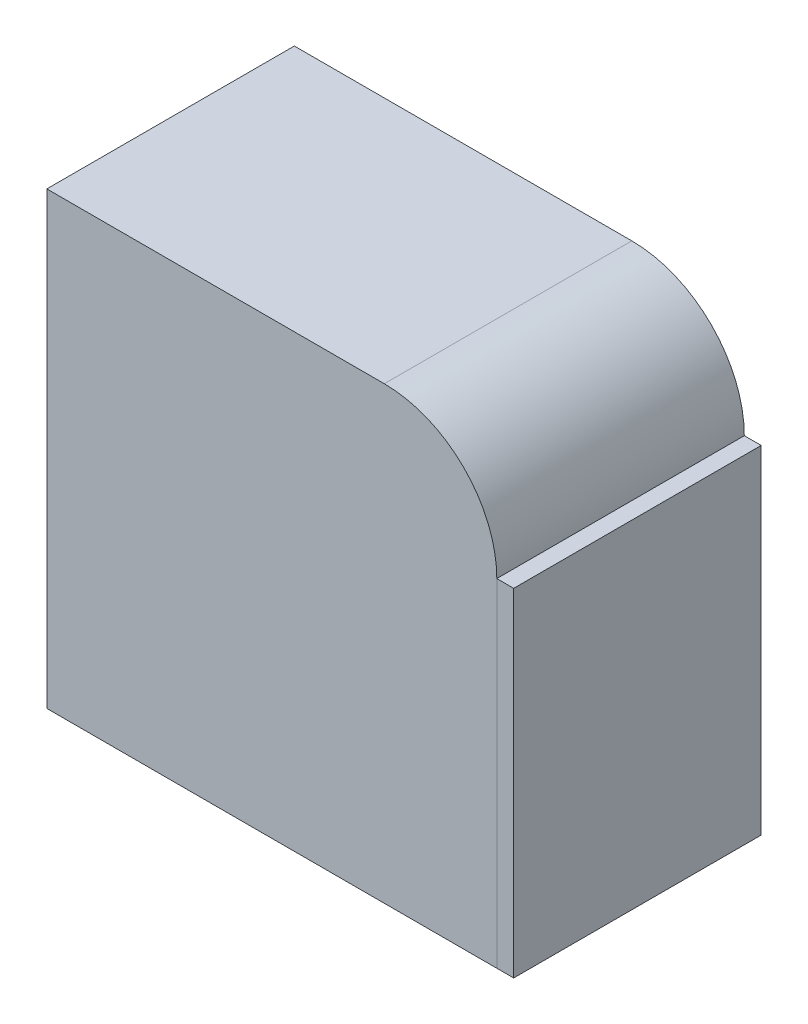
from build123d import *

# Parameters (mm, degrees)
BOSS_EXTRU_1_DEPTH = 11
ESQUISSE2_W        = 22
ESQUISSE2_H        = 30
BOSS_EXTRU_2_DEPTH = 1.5


with BuildPart() as part:
    # Esquisse1 → Boss.-Extru.1 (new, symmetric)
    with BuildSketch(Plane.XY):
        with BuildLine():
            Line((-58, -15), (-28, -15))
            ThreePointArc((-28, -15), (-20.928932188, -17.928932188), (-18, -25))
            Line((-18, -25), (-18, -55))
            Line((-18, -55), (-58, -55))
            Line((-58, -55), (-58, -15))
        make_face()
    extrude(amount=BOSS_EXTRU_1_DEPTH, both=True)


with BuildPart() as body_2:
    # Esquisse2 → Boss.-Extru.2 (new body)
    with BuildSketch(Plane(origin=(-18, 0, 0), x_dir=(0, 0, -1), z_dir=(1, 0, 0))):
        with Locations((0, -40)):
            Rectangle(ESQUISSE2_W, ESQUISSE2_H)
    extrude(amount=BOSS_EXTRU_2_DEPTH)


solid = Compound([part.part, body_2.part])
